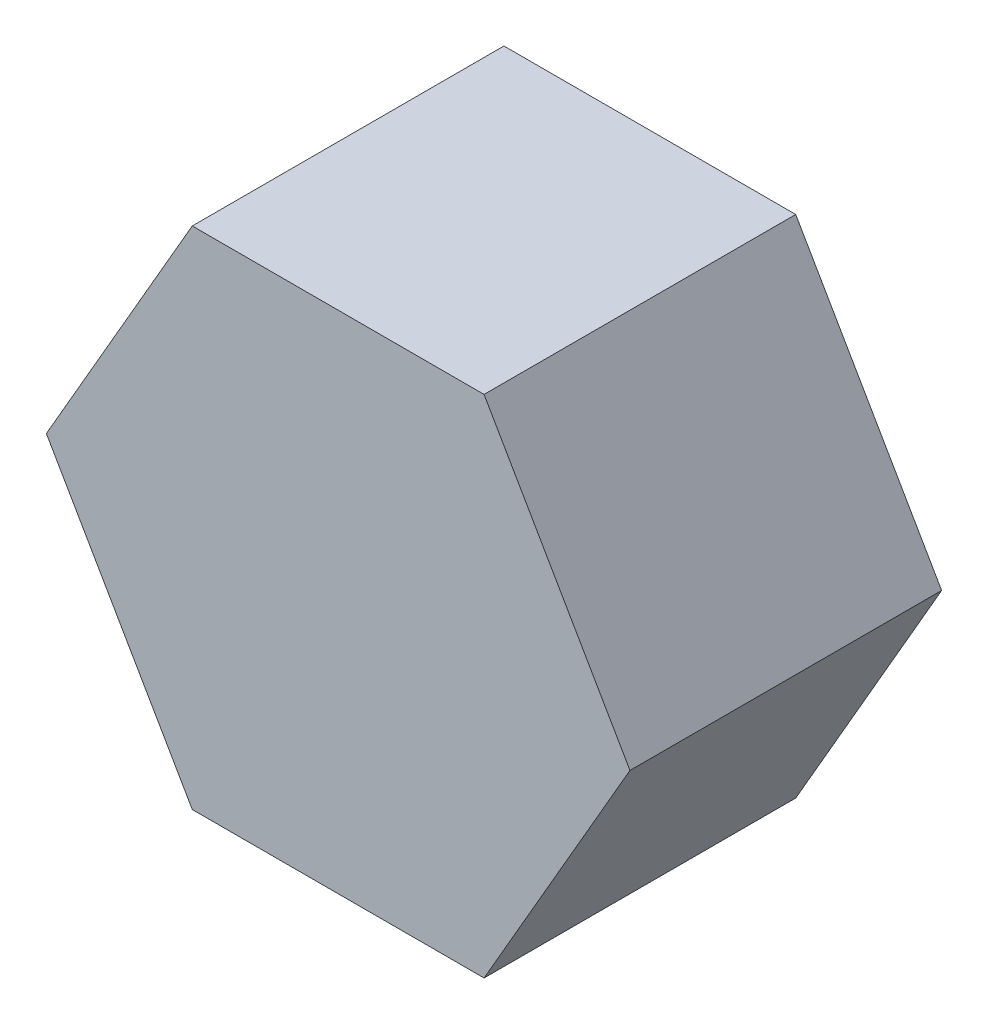
from build123d import *

# Parameters (mm, degrees)
EXTRUDE_1_DEPTH = 14.8


with BuildPart() as part:
    # 草图1 → 凸台-拉伸1 (new body)
    with BuildSketch(Plane.XY):
        Polygon((13.856, 0), (6.928, 11.999647995), (-6.928, 11.999647995), (-13.856, 0), (-6.928, -11.999647995), (6.928, -11.999647995), align=None)
    extrude(amount=EXTRUDE_1_DEPTH)


solid = part.part
